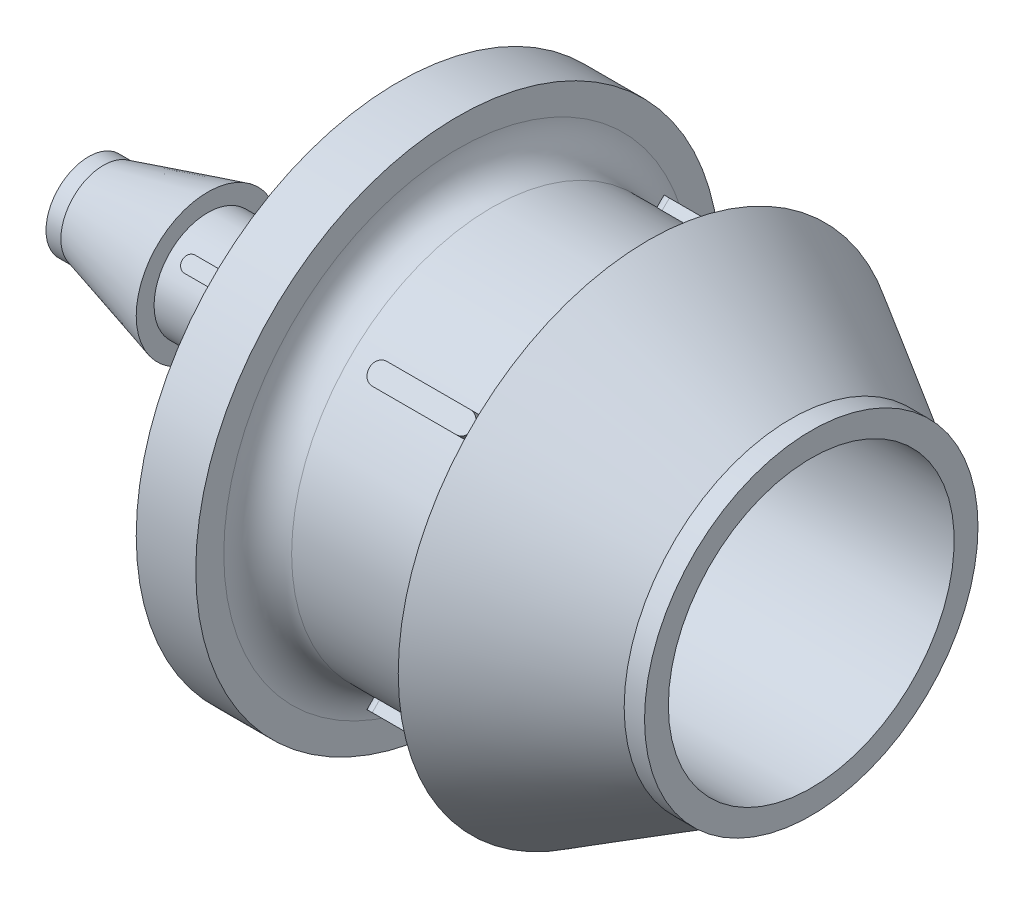
from build123d import *

# Parameters (mm, degrees)
EXTRUDE1_DEPTH     = 11.2014
EXTRUDE2_DEPTH     = 3.000375
CIRPATTERN1_COUNT  = 2
CIRPATTERN1_ANGLE  = 90
SKETCH4_R          = 7.62
CUT_EXTRUDE1_DEPTH = 20.4343
SKETCH7_R          = 1.8161
CUT_EXTRUDE2_DEPTH = 44.301517424


with BuildPart() as part:
    # Sketch1 → Revolve1 (revolve)
    with BuildSketch(Plane.XY, mode=Mode.PRIVATE) as revolve1_sk:
        Polygon((20.4343, 7.62), (20.4343, 8.89), (19.34845, 8.89), (11.7475, 13.335), (11.7475, 10.668), (1.5875, 10.668), (1.5875, 13.97), (-1.5875, 13.97), (-1.5875, 2.8575), (-11.7475, 2.8575), (-11.7475, 3.81), (-17.30375, 2.270125), (-18.0975, 2.270125), (-18.0975, 1.8161), (1.5875, 1.8161), (1.5875, 7.62), align=None)
    revolve(revolve1_sk.sketch.rotate(Axis((0, 0, 0), (1, 0, 0)), 90), axis=Axis((0, 0, 0), (1, 0, 0)))

    # Sketch2 → Revolve2 (revolve)
    with BuildSketch(Plane.XY, mode=Mode.PRIVATE) as revolve2_sk:
        with BuildLine():
            Line((3.39598, 10.668), (1.5875, 10.668))
            Line((1.5875, 10.668), (1.5875, 12.47648))
            ThreePointArc((1.5875, 12.47648), (2.117191528, 11.197691528), (3.39598, 10.668))
        make_face()
        with BuildLine():
            Line((-7.14375, 2.8575), (-1.5875, 2.8575))
            Line((-1.5875, 2.8575), (-1.5875, 8.41375))
            ThreePointArc((-1.5875, 8.41375), (-3.214887947, 4.484887947), (-7.14375, 2.8575))
        make_face()
    revolve(revolve2_sk.sketch.rotate(Axis((0, 0, 0), (1, 0, 0)), 90), axis=Axis((0, 0, 0), (1, 0, 0)))

    # Sketch3 → Extrude1 (add, symmetric)
    with BuildSketch(Plane(origin=(0, 0, 0), x_dir=(-1, 0, 0), z_dir=(0, 0.7071067811865488, 0.7071067811865462))):
        with BuildLine():
            Line((-5.330825, 0.542925), (-9.812655, 0.542925))
            ThreePointArc((-9.812655, 0.542925), (-10.35558, 0), (-9.812655, -0.542925))
            Line((-9.812655, -0.542925), (-5.330825, -0.542925))
            ThreePointArc((-5.330825, -0.542925), (-4.7879, 0), (-5.330825, 0.542925))
        make_face()
    extrude1 = extrude(amount=EXTRUDE1_DEPTH, both=True)

    # Sketch6 → Extrude2 (add, symmetric)
    with BuildSketch(Plane(origin=(0, 0, 0), x_dir=(-1, 0, 0), z_dir=(0, 0.7071067811865488, 0.7071067811865462))):
        with BuildLine():
            Line((8.307916667, 0.396875), (10.583333333, 0.396875))
            ThreePointArc((10.583333333, 0.396875), (10.980208333, 0), (10.583333333, -0.396875))
            Line((10.583333333, -0.396875), (8.307916667, -0.396875))
            ThreePointArc((8.307916667, -0.396875), (7.911041667, 0), (8.307916667, 0.396875))
        make_face()
    extrude2 = extrude(amount=EXTRUDE2_DEPTH, both=True)

    # CirPattern1: Extrude1, Extrude2 ×2 about axis
    cirpattern1_axis = Axis((0, 0, 0), (1, 0, 0))
    add([extrude1.rotate(cirpattern1_axis, i * CIRPATTERN1_ANGLE / (CIRPATTERN1_COUNT - 1)) for i in range(1, CIRPATTERN1_COUNT)])
    add([extrude2.rotate(cirpattern1_axis, i * CIRPATTERN1_ANGLE / (CIRPATTERN1_COUNT - 1)) for i in range(1, CIRPATTERN1_COUNT)])

    # Sketch4 → Cut-Extrude1 (cut)
    with BuildSketch(Plane(origin=(20.4343, 0, 0), x_dir=(0, 0, -1), z_dir=(1, 0, 0))):
        with Locations(Location((0, 0, 0), (0, 0, 180))):
            Circle(SKETCH4_R)
    extrude(amount=-CUT_EXTRUDE1_DEPTH, mode=Mode.SUBTRACT)

    # Sketch7 → Cut-Extrude2 (cut, through all)
    with BuildSketch(Plane.ZY.offset(18.0975)):
        Circle(SKETCH7_R)
    extrude(amount=-CUT_EXTRUDE2_DEPTH, mode=Mode.SUBTRACT)


solid = part.part
